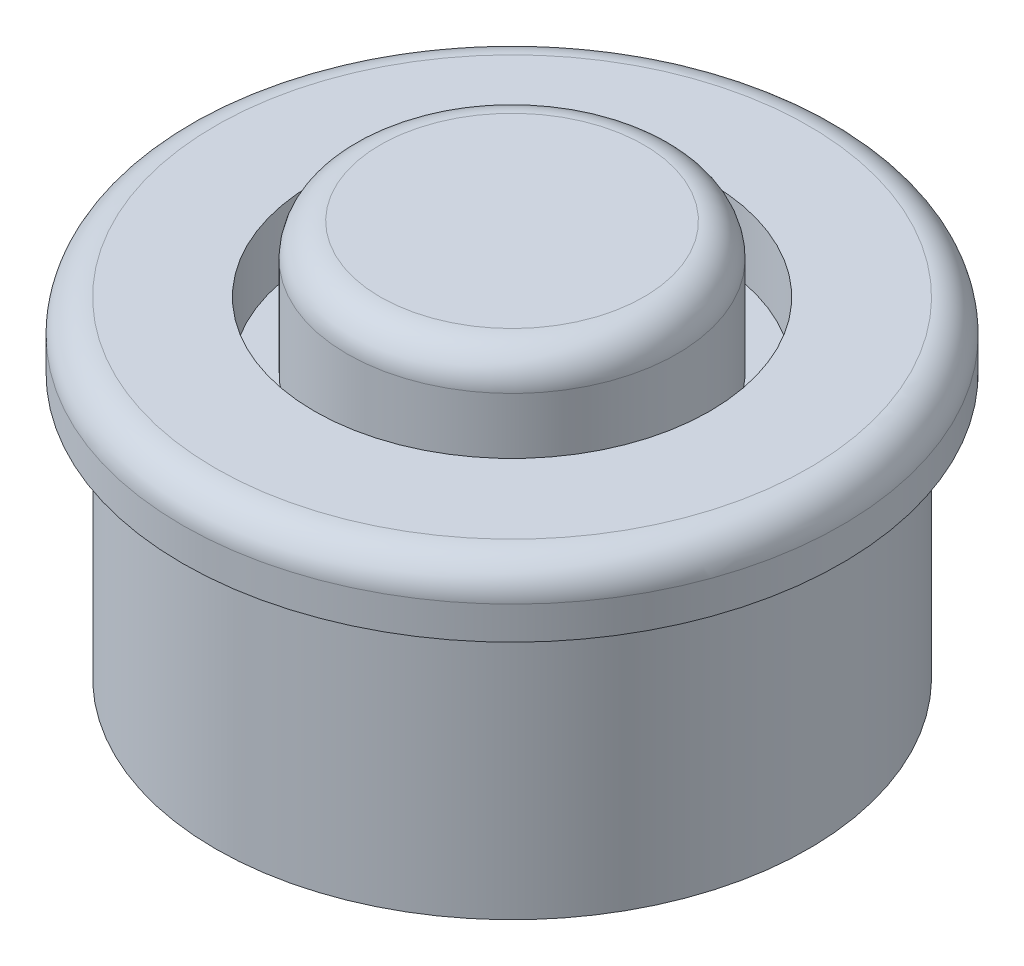
from build123d import *

# Parameters (mm, degrees)
SKETCH1_R           = 10
SKETCH1_R_2         = 6
BOSS_EXTRUDE1_DEPTH = 2
SKETCH2_R           = 9
BOSS_EXTRUDE2_DEPTH = 8
SKETCH3_R           = 5
BOSS_EXTRUDE3_DEPTH = 4
FILLET1_R           = 1


with BuildPart() as part:
    # Sketch1 → Boss-Extrude1 (new body)
    with BuildSketch(Plane(origin=(0, 0, 0), x_dir=(1, 0, 0), z_dir=(0, 1, 0))):
        with Locations(Location((0, 0, 0), (0, 0, 270))):
            Circle(SKETCH1_R)
        with Locations(Location((0, 0, 0), (0, 0, 270))):
            Circle(SKETCH1_R_2, mode=Mode.SUBTRACT)
    extrude(amount=BOSS_EXTRUDE1_DEPTH)

    # Sketch2 → Boss-Extrude2 (add)
    with BuildSketch(Plane(origin=(0, 0, 0), x_dir=(1, 0, 0), z_dir=(0, 1, 0))):
        with Locations(Location((0, 0, 0), (0, 0, 270))):
            Circle(SKETCH2_R)
    extrude(amount=-BOSS_EXTRUDE2_DEPTH)

    # Sketch3 → Boss-Extrude3 (add)
    with BuildSketch(Plane(origin=(0, 0, 0), x_dir=(1, 0, 0), z_dir=(0, 1, 0))):
        with Locations(Location((0, 0, 0), (0, 0, 270))):
            Circle(SKETCH3_R)
    extrude(amount=BOSS_EXTRUDE3_DEPTH)

    # Fillet1
    fillet1_edges = [part.edges().sort_by_distance(p)[0] for p in [
        (0, 4, -5),
        (0, 2, -10),
    ]]
    fillet(fillet1_edges, radius=FILLET1_R)


solid = part.part
